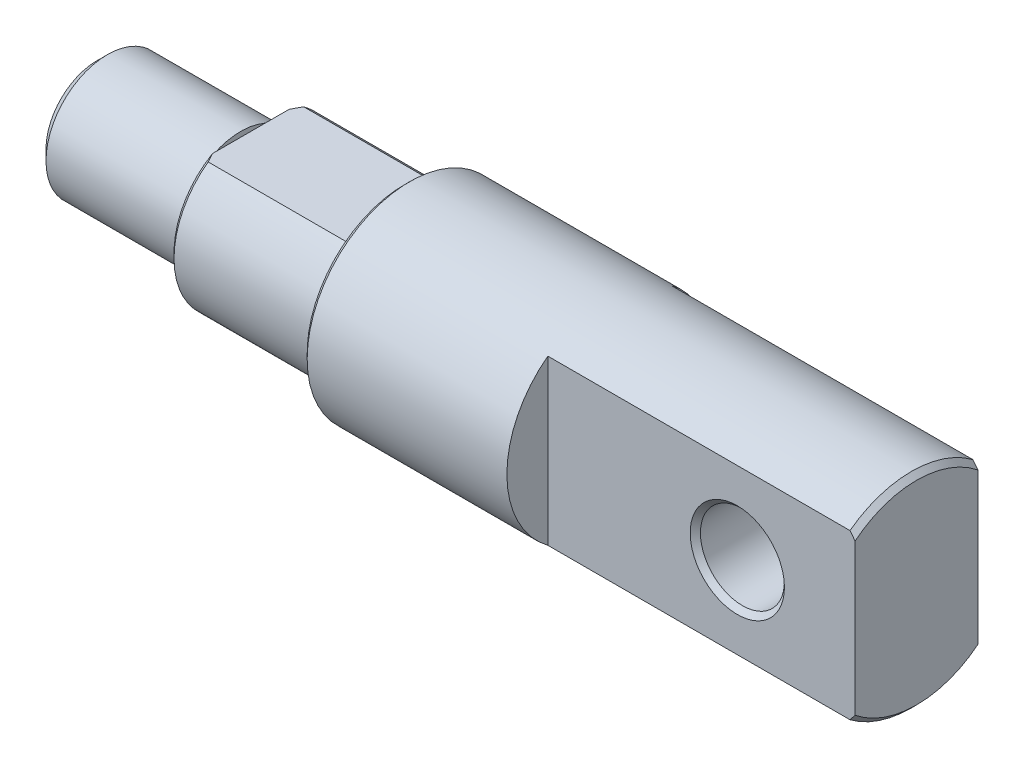
from build123d import *

# Parameters (mm, degrees)
CHANFREIN1_SIZE         = 0.5
CHANFREIN2_SIZE         = 1
ESQUISSE2_W             = 9
ESQUISSE2_H             = 30
ENL_V_MAT_EXTRU_1_DEPTH = 30
ENL_V_MAT_EXTRU_2_REACH = 84.195
ESQUISSE3_R             = 4.1
CHANFREIN3_SIZE         = 0.5
ENL_V_MAT_EXTRU_3_REACH = 53.962
ESQUISSE5_W             = 20
ESQUISSE5_H             = 3.5


with BuildPart() as part:
    # Esquisse1 → Révolution1 (revolve)
    with BuildSketch(Plane.XY, mode=Mode.PRIVATE) as r_volution1_sk:
        Polygon((-50, 8), (-65, 8), (-65, 5), (-66, 5), (-66, 6), (-80, 6), (-80, 0), (0, 0), (0, 10), (-50, 10), align=None)
    revolve(r_volution1_sk.sketch.rotate(Axis((0, 0, 0), (1, 0, 0)), 90), axis=Axis((0, 0, 0), (1, 0, 0)))

    # Chanfrein1
    chanfrein1_edges = [part.edges().sort_by_distance(p)[0] for p in [
        (-50, 0, -10),
        (0, 0, -10),
        (-65, 0, -8),
    ]]
    chamfer(chanfrein1_edges, length=CHANFREIN1_SIZE)

    # Chanfrein2
    chanfrein2_edges = [part.edges().sort_by_distance(p)[0] for p in [
        (-80, 0, -6),
    ]]
    chamfer(chanfrein2_edges, length=CHANFREIN2_SIZE)

    # Esquisse2 → Enlèv. mat.-Extru.1 (cut)
    with BuildSketch(Plane(origin=(0, 0, 0), x_dir=(0, 0, -1), z_dir=(1, 0, 0))):
        with Locations((-10.5, 0)):
            Rectangle(ESQUISSE2_W, ESQUISSE2_H)
        with Locations((10.5, 0)):
            Rectangle(ESQUISSE2_W, ESQUISSE2_H)
    extrude(amount=-ENL_V_MAT_EXTRU_1_DEPTH, mode=Mode.SUBTRACT)

    # Esquisse3 → Enlèv. mat.-Extru.2 (cut, up to next)
    with BuildSketch(Plane.XY.offset(6), mode=Mode.PRIVATE) as enl_v_mat_extru_2_sk1:
        with Locations((-11.5, 0)):
            Circle(ESQUISSE3_R)
    enl_v_mat_extru_2_tool1 = extrude(enl_v_mat_extru_2_sk1.sketch, amount=-ENL_V_MAT_EXTRU_2_REACH, mode=Mode.PRIVATE) & part.part
    add(enl_v_mat_extru_2_tool1.solids().sort_by_distance((-11.5, 0, 6))[0], mode=Mode.SUBTRACT)

    # Chanfrein3
    chanfrein3_edges = [part.edges().sort_by_distance(p)[0] for p in [
        (-15.6, 0, 6),
        (-15.6, 0, -6),
    ]]
    chamfer(chanfrein3_edges, length=CHANFREIN3_SIZE)

    # Esquisse5 → Enlèv. mat.-Extru.3 (cut, up to next)
    with BuildSketch(Plane.ZY.offset(50), mode=Mode.PRIVATE) as enl_v_mat_extru_3_sk1:
        with Locations((0, 8.25)):
            Rectangle(ESQUISSE5_W, ESQUISSE5_H)
    enl_v_mat_extru_3_tool1 = extrude(enl_v_mat_extru_3_sk1.sketch, amount=ENL_V_MAT_EXTRU_3_REACH, mode=Mode.PRIVATE) & part.part
    # Esquisse5 → Enlèv. mat.-Extru.3 (cut, up to next)
    with BuildSketch(Plane.ZY.offset(50), mode=Mode.PRIVATE) as enl_v_mat_extru_3_sk2:
        with Locations((0, -8.25)):
            Rectangle(ESQUISSE5_W, ESQUISSE5_H)
    enl_v_mat_extru_3_tool2 = extrude(enl_v_mat_extru_3_sk2.sketch, amount=ENL_V_MAT_EXTRU_3_REACH, mode=Mode.PRIVATE) & part.part
    add(enl_v_mat_extru_3_tool1.solids().sort_by_distance((-50, 8.25, 0))[0], mode=Mode.SUBTRACT)
    add(enl_v_mat_extru_3_tool2.solids().sort_by_distance((-50, -8.25, 0))[0], mode=Mode.SUBTRACT)


solid = part.part
